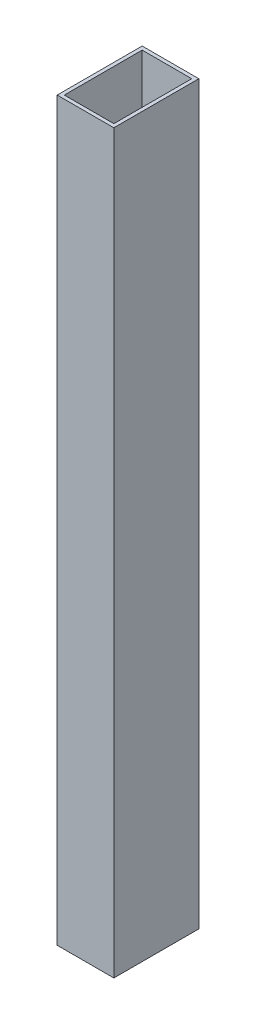
from build123d import *

# Parameters (mm, degrees)
SKETCH1_W           = 50.8
SKETCH1_H           = 76.2
BOSS_EXTRUDE1_DEPTH = 660.4
SHELL1_T            = -3.175


with BuildPart() as part:
    # Sketch1 → Boss-Extrude1 (new body)
    with BuildSketch(Plane(origin=(0, 0, 0), x_dir=(1, 0, 0), z_dir=(0, 1, 0))):
        Rectangle(SKETCH1_W, SKETCH1_H)
    extrude(amount=BOSS_EXTRUDE1_DEPTH)

    # Shell1
    shell1_openings = [part.faces().sort_by_distance(p)[0] for p in [
        (0, 660.4, 0),
        (0, 0, 0),
    ]]
    offset(amount=SHELL1_T, openings=shell1_openings, kind=Kind.INTERSECTION)


solid = part.part
